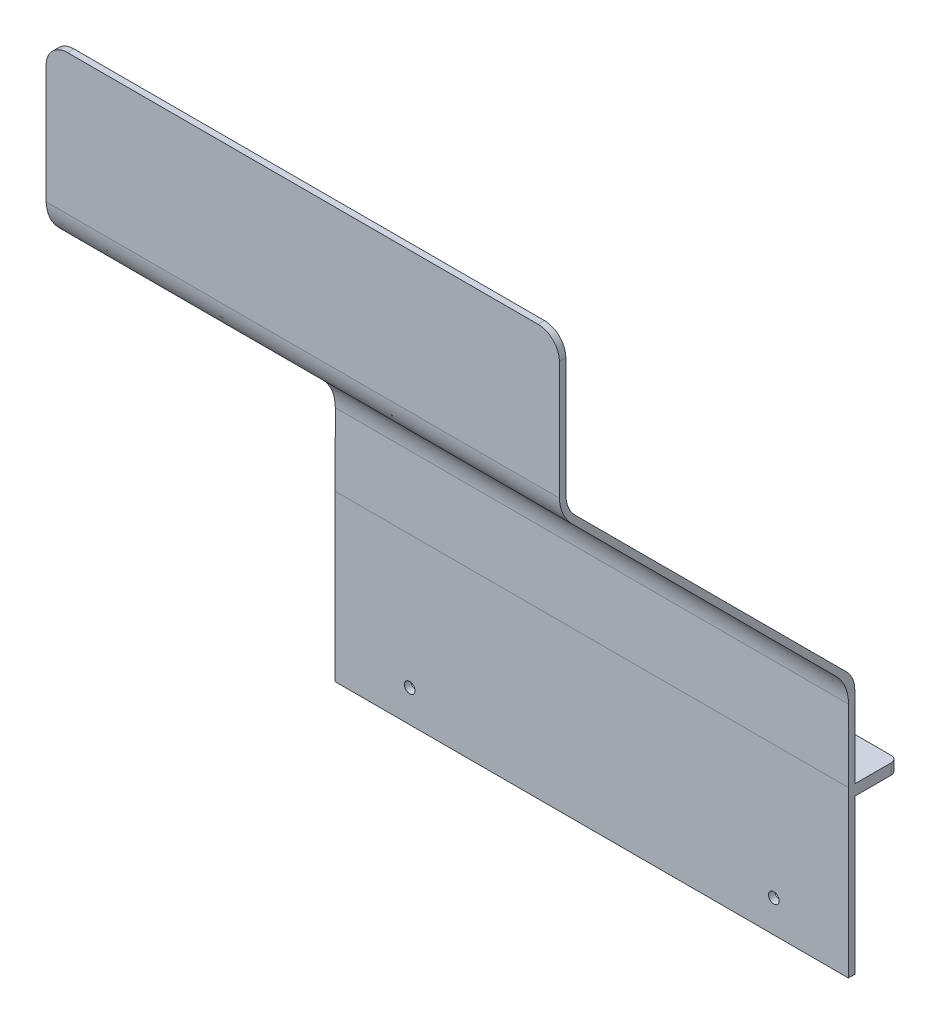
from build123d import *

# Parameters (mm, degrees)
SKETCH1_W           = 250
SKETCH1_H           = 72
BOSS_EXTRUDE1_DEPTH = 3
SKETCH2_W           = 239.6
SKETCH2_H           = 23
BOSS_EXTRUDE2_DEPTH = 5
SKETCH3_R           = 2.5
CUT_EXTRUDE1_DEPTH  = 5
FILLET1_R           = 3
SKETCH4_R           = 2.5
CUT_EXTRUDE2_DEPTH  = 5
SKETCH6_W           = 5.2
SKETCH6_H           = 72
CUT_EXTRUDE3_DEPTH  = 5
BOSS_EXTRUDE3_DEPTH = 239.6
SKETCH8_W           = 239.6
SKETCH8_H           = 3
BOSS_EXTRUDE4_DEPTH = 3
FILLET3_R           = 10
SKETCH10_R          = 1.8
CUT_EXTRUDE5_DEPTH  = 5


with BuildPart() as part:
    # Sketch1 → Boss-Extrude1 (new body)
    with BuildSketch(Plane.XY):
        Rectangle(SKETCH1_W, SKETCH1_H)
    extrude(amount=BOSS_EXTRUDE1_DEPTH)

    # Sketch2 → Boss-Extrude2 (add)
    with BuildSketch(Plane(origin=(0, 36, 0), x_dir=(1, 0, 0), z_dir=(0, 1, 0))):
        with Locations((0, 8.5)):
            Rectangle(SKETCH2_W, SKETCH2_H)
    extrude(amount=BOSS_EXTRUDE2_DEPTH)

    # Sketch3 → Cut-Extrude1 (cut)
    with BuildSketch(Plane(origin=(0, 41, 0), x_dir=(1, 0, 0), z_dir=(0, 1, 0))):
        with Locations(Location((-65, 8.5, 0), (0, 0, 180))):
            Circle(SKETCH3_R)
        with Locations((65, 8.5)):
            Circle(SKETCH3_R)
    extrude(amount=-CUT_EXTRUDE1_DEPTH, mode=Mode.SUBTRACT)

    # Fillet1
    fillet1_edges = [part.edges().sort_by_distance(p)[0] for p in [
        (-119.8, 38.5, -20),
        (119.8, 38.5, -20),
    ]]
    fillet(fillet1_edges, radius=FILLET1_R)

    # Sketch4 → Cut-Extrude2 (cut)
    with BuildSketch(Plane.XY.offset(3)):
        with Locations((-85, -21)):
            Circle(SKETCH4_R)
        with Locations((85, -21)):
            Circle(SKETCH4_R)
    extrude(amount=-CUT_EXTRUDE2_DEPTH, mode=Mode.SUBTRACT)

    # Sketch6 → Cut-Extrude3 (cut)
    with BuildSketch(Plane.XY.offset(3)):
        with Locations((-122.4, 0)):
            Rectangle(SKETCH6_W, SKETCH6_H)
        with Locations((122.4, 0)):
            Rectangle(SKETCH6_W, SKETCH6_H)
    extrude(amount=-CUT_EXTRUDE3_DEPTH, mode=Mode.SUBTRACT)

    # Sketch7 → Boss-Extrude3 (add)
    with BuildSketch(Plane.ZY.offset(119.8)):
        with BuildLine():
            Line((0, 41), (3, 41))
            Line((3, 41), (2.916490723, 74.715728753))
            add(Edge.make_bspline(
                [(2.916490723, 74.715728753), (3.032377234, 82.951998235), (8.774355099, 88.857864376)],
                knots=[0, 0, 0, 1, 1, 1], degree=2))
            Line((8.774355099, 88.857864376), (132.058626347, 212.142135624))
            add(Edge.make_bspline(
                [(132.058626347, 212.142135624), (137.487179548, 217.729604737), (137.916490723, 225.455844123)],
                knots=[0, 0, 0, 1, 1, 1], degree=2))
            Line((137.916490723, 225.455844123), (137.916490723, 287.774355099))
            Line((137.916490723, 287.774355099), (134.916490723, 287.774355099))
            Line((134.916490723, 287.774355099), (134.916490723, 225.455844123))
            ThreePointArc((134.916490723, 225.455844123), (133.774683711, 219.715592637), (130.523092441, 214.849242405))
            Line((130.523092441, 214.849242405), (3.803620061, 88.129770025))
            ThreePointArc((3.803620061, 88.129770025), (0.988528647, 83.916687992), (0, 78.947018888))
            Line((0, 78.947018888), (0, 41))
        make_face()
    extrude(amount=-BOSS_EXTRUDE3_DEPTH)

    # Sketch8 → Boss-Extrude4 (add)
    with BuildSketch(Plane.XY.offset(137.916490723)):
        with Locations((0, 289.274355099)):
            Rectangle(SKETCH8_W, SKETCH8_H)
    extrude(amount=-BOSS_EXTRUDE4_DEPTH)

    # Fillet3
    fillet3_edges = [part.edges().sort_by_distance(p)[0] for p in [
        (-119.8, 290.774355099, 136.416490723),
        (119.8, 290.774355099, 136.416490723),
    ]]
    fillet(fillet3_edges, radius=FILLET3_R)

    # Sketch10 → Cut-Extrude5 (cut)
    with BuildSketch(Plane(origin=(0, 42.163074982, -42.163074982), x_dir=(1, 0, 0), z_dir=(0, 0.7071067811865429, -0.7071067811865522))):
        with Locations(Location((107.5, -168.386692879, 0), (0, 0, 270))):
            Circle(SKETCH10_R)
        with Locations(Location((-107.5, -168.386692879, 0), (0, 0, 270))):
            Circle(SKETCH10_R)
    extrude(amount=-CUT_EXTRUDE5_DEPTH, mode=Mode.SUBTRACT)


solid = part.part
